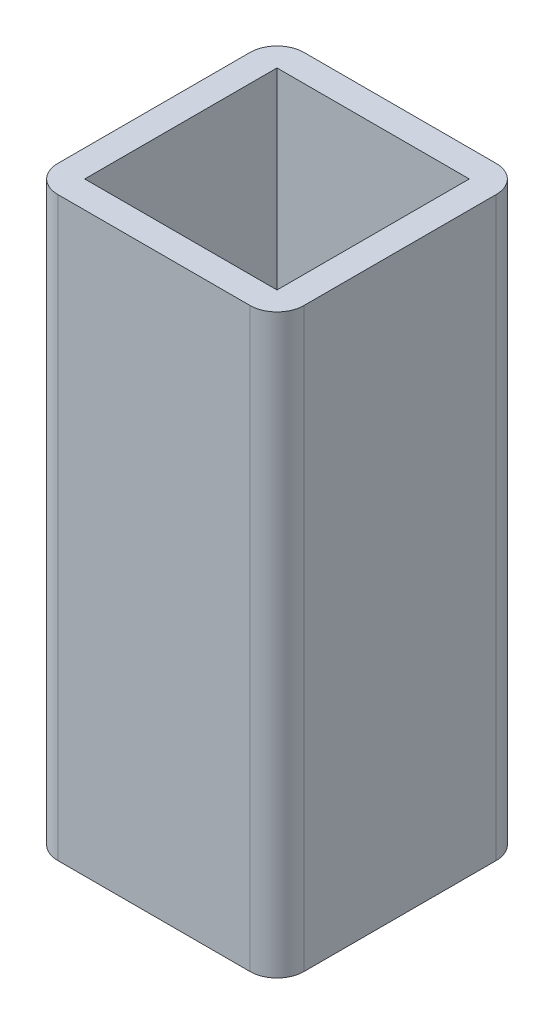
from build123d import *

# Parameters (mm, degrees)
BOSS_EXTRUDE1_DEPTH = 60
SKETCH3_W           = 20
SKETCH3_H           = 20
CUT_EXTRUDE1_DEPTH  = 1040.5


with BuildPart() as part:
    # Sketch1 → Boss-Extrude1 (new body)
    with BuildSketch(Plane(origin=(0, 0, 0), x_dir=(1, 0, 0), z_dir=(0, 1, 0))):
        with BuildLine():
            Line((2.8, 0), (22.8, 0))
            ThreePointArc((22.8, 0), (24.779898987, -0.820101013), (25.6, -2.8))
            Line((25.6, -2.8), (25.6, -22.8))
            ThreePointArc((25.6, -22.8), (24.779898987, -24.779898987), (22.8, -25.6))
            Line((22.8, -25.6), (2.8, -25.6))
            ThreePointArc((2.8, -25.6), (0.820101013, -24.779898987), (0, -22.8))
            Line((0, -22.8), (0, -2.8))
            ThreePointArc((0, -2.8), (0.820101013, -0.820101013), (2.8, 0))
        make_face()
    extrude(amount=BOSS_EXTRUDE1_DEPTH)

    # Sketch3 → Cut-Extrude1 (cut)
    with BuildSketch(Plane(origin=(0, 0, 0), x_dir=(-1, 0, 0), z_dir=(0, -1, 0))):
        with Locations((-12.8, -12.8)):
            Rectangle(SKETCH3_W, SKETCH3_H)
    extrude(amount=-CUT_EXTRUDE1_DEPTH, mode=Mode.SUBTRACT)


solid = part.part
